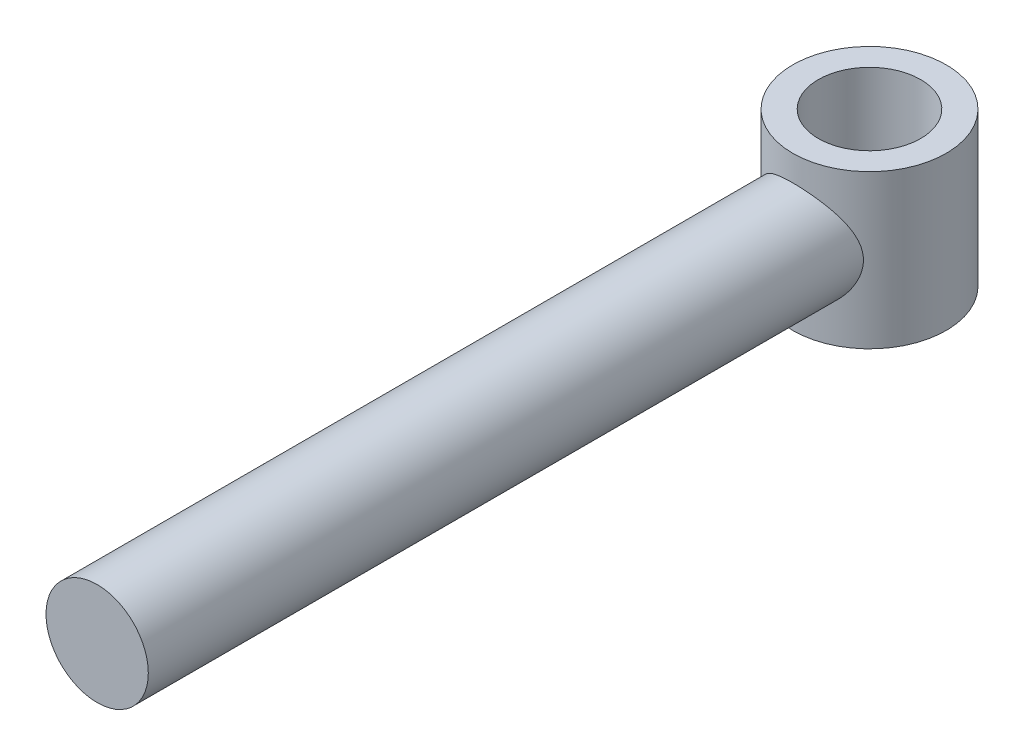
from build123d import *

# Parameters (mm, degrees)
SKETCH1_R           = 12.7
BOSS_EXTRUDE1_DEPTH = 177.8
SKETCH2_R           = 19.05
SKETCH2_R_2         = 12.7
BOSS_EXTRUDE2_DEPTH = 19.05


with BuildPart() as part:
    # Sketch1 → Boss-Extrude1 (new body)
    with BuildSketch(Plane.XY):
        Circle(SKETCH1_R)
    extrude(amount=BOSS_EXTRUDE1_DEPTH)

    # Sketch2 → Boss-Extrude2 (add, symmetric)
    with BuildSketch(Plane(origin=(0, 0, 0), x_dir=(1, 0, 0), z_dir=(0, 1, 0))):
        with Locations(Location((0, 13.97, 0), (0, 0, 270))):
            Circle(SKETCH2_R)
        with Locations(Location((0, 13.97, 0), (0, 0, 90))):
            Circle(SKETCH2_R_2, mode=Mode.SUBTRACT)
    extrude(amount=BOSS_EXTRUDE2_DEPTH, both=True)


solid = part.part
